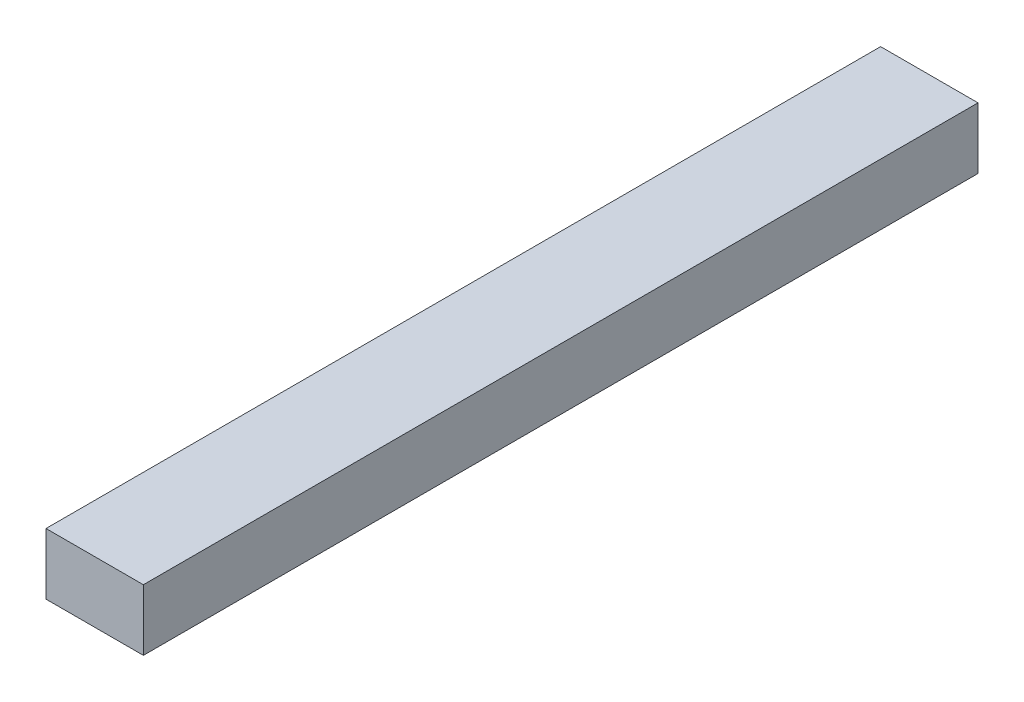
from build123d import *

# Parameters (mm, degrees)
SKETCH2_W      = 70
SKETCH2_H      = 44
EXTRUDE1_DEPTH = 600


with BuildPart() as part:
    # Sketch2 → Extrude1 (new body)
    with BuildSketch(Plane.XY):
        with Locations((35, 22)):
            Rectangle(SKETCH2_W, SKETCH2_H)
    extrude(amount=EXTRUDE1_DEPTH)


solid = part.part
